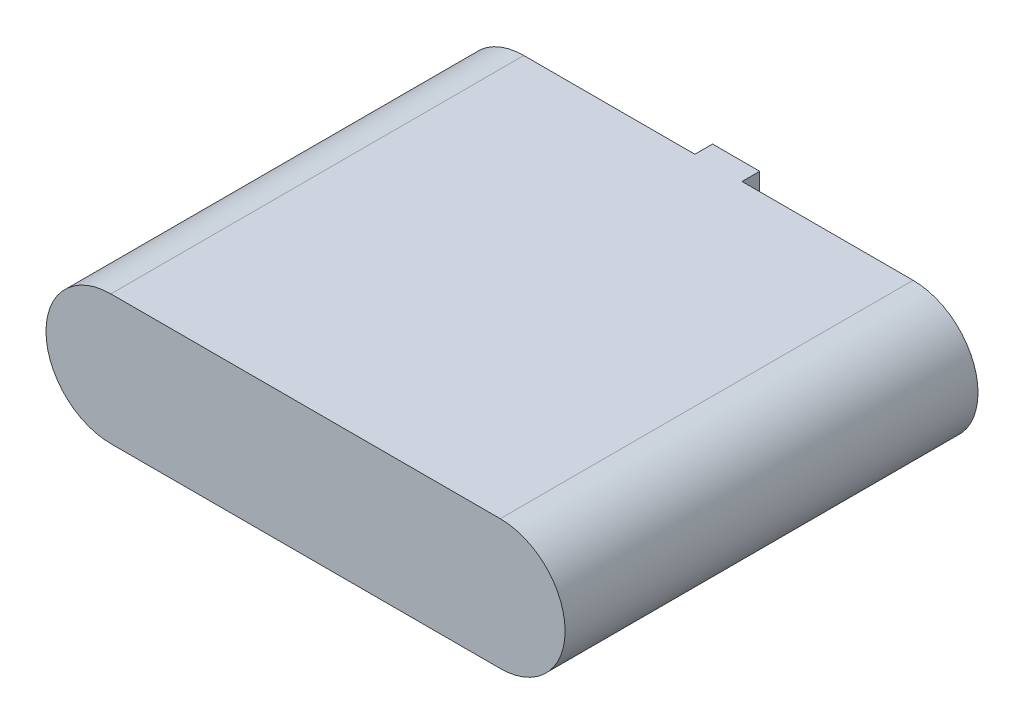
from build123d import *

# Parameters (mm, degrees)
EXTRUDE_1_DEPTH = 70
SKETCH_2_W      = 8
SKETCH_2_H      = 4
EXTRUDE_2_DEPTH = 3


with BuildPart() as part:
    # 草图1 → 凸台-拉伸1 (new body)
    with BuildSketch(Plane.XY):
        with BuildLine():
            Line((0, 11), (66, 11))
            ThreePointArc((66, 11), (77, 0), (66, -11))
            Line((66, -11), (0, -11))
            ThreePointArc((0, -11), (-11, 0), (0, 11))
        make_face()
    extrude(amount=EXTRUDE_1_DEPTH)

    # 草图2 → 凸台-拉伸2 (add)
    with BuildSketch(Plane(origin=(0, 0, 0), x_dir=(-1, 0, 0), z_dir=(0, 0, -1))):
        with Locations((-33, 9)):
            Rectangle(SKETCH_2_W, SKETCH_2_H)
    extrude(amount=EXTRUDE_2_DEPTH)


solid = part.part
